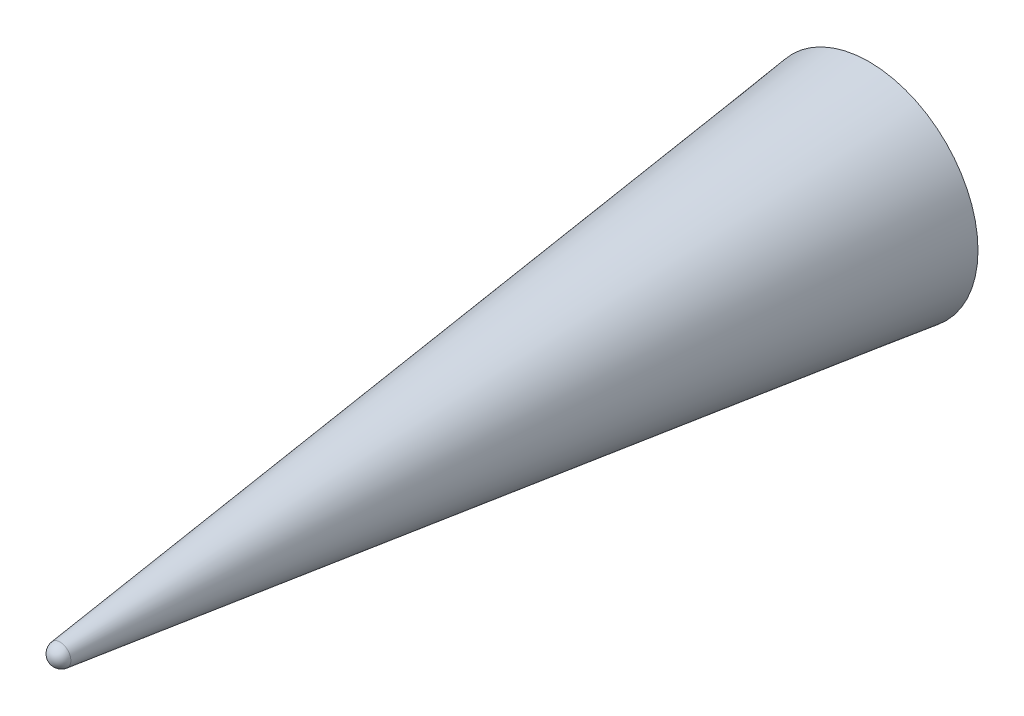
from build123d import *


with BuildPart() as part:
    # Sketch1 → Revolve1 (revolve)
    with BuildSketch(Plane(origin=(0, 0, 0), x_dir=(0, 0, -1), z_dir=(1, 0, 0)), mode=Mode.PRIVATE) as revolve1_sk:
        with BuildLine():
            Line((-381.963243848, 0), (0, 0))
            Line((0, 0), (0, 50.8))
            Line((0, 50.8), (-377.494527195, 5.043087613))
            ThreePointArc((-377.494527195, 5.043087613), (-380.685330078, 3.369056292), (-381.963243848, 0))
        make_face()
    revolve(revolve1_sk.sketch.rotate(Axis((0, 0, 477.571752055), (0, 0, -1)), 270), axis=Axis((0, 0, 477.571752055), (0, 0, -1)))


solid = part.part
